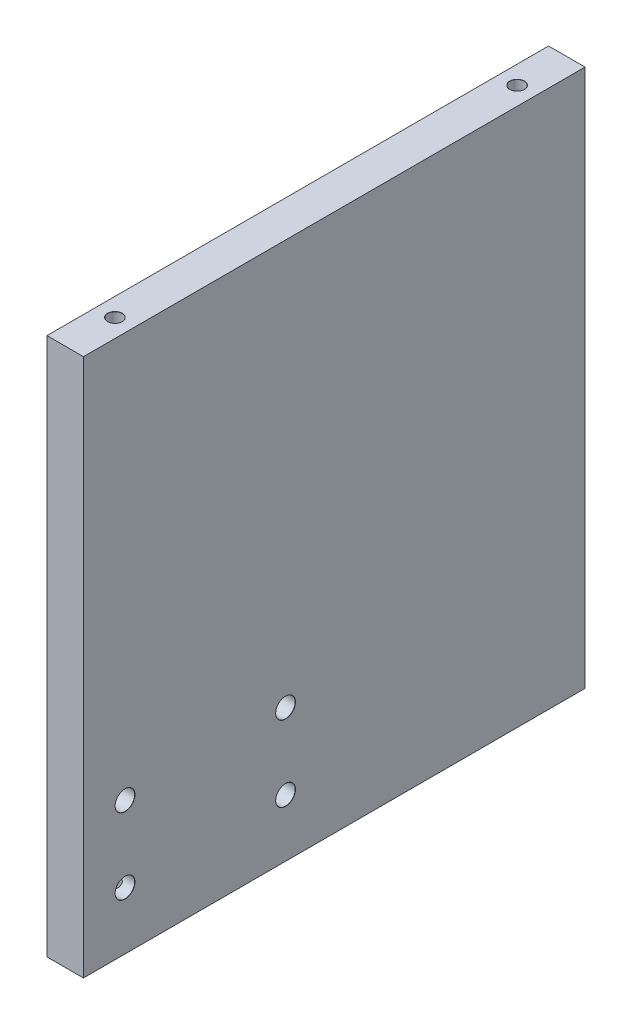
from build123d import *

# Parameters (mm, degrees)
SKETCH1_W                             = 87.3
SKETCH1_H                             = 93.65
BOSS_EXTRUDE1_DEPTH                   = 6.35
TAP_DRILL_FOR_M3X0_5_TAP1_D           = 2.5
TAP_DRILL_FOR_M3X0_5_TAP1_DEPTH       = 10
TAP_DRILL_FOR_M3X0_5_TAP1_CSINK_D     = 2.55
TAP_DRILL_FOR_M3X0_5_TAP1_CSINK_ANGLE = 90
TAP_DRILL_FOR_M3X0_5_TAP1_TIP         = 0.751075774
TAP_DRILL_FOR_M3X0_5_TAP2_D           = 2.5
TAP_DRILL_FOR_M3X0_5_TAP2_DEPTH       = 9.248924226
TAP_DRILL_FOR_M3X0_5_TAP2_CSINK_D     = 2.55
TAP_DRILL_FOR_M3X0_5_TAP2_CSINK_ANGLE = 90
TAP_DRILL_FOR_M3X0_5_TAP2_TIP         = 0.751075774
M3_CLEARANCE_HOLE1_D                  = 3.4
M3_CLEARANCE_HOLE1_CSINK_D            = 3.45
M3_CLEARANCE_HOLE1_CSINK_ANGLE        = 90


with BuildPart() as part:
    # Sketch1 → Boss-Extrude1 (new body)
    with BuildSketch(Plane(origin=(0, 0, 0), x_dir=(0, 0, -1), z_dir=(1, 0, 0))):
        Rectangle(SKETCH1_W, SKETCH1_H)
    extrude(amount=BOSS_EXTRUDE1_DEPTH)

    # Tap Drill for M3x0.5 Tap1
    with Locations(Plane(origin=(0, 46.825, 0), x_dir=(1, 0, 0), z_dir=(0, 1, 0))):
        with Locations((3.175, 35), (3.175, -35)):
            CounterSinkHole(TAP_DRILL_FOR_M3X0_5_TAP1_D / 2, TAP_DRILL_FOR_M3X0_5_TAP1_CSINK_D / 2, depth=TAP_DRILL_FOR_M3X0_5_TAP1_DEPTH, counter_sink_angle=TAP_DRILL_FOR_M3X0_5_TAP1_CSINK_ANGLE)
            with Locations((0, 0, -(TAP_DRILL_FOR_M3X0_5_TAP1_DEPTH + TAP_DRILL_FOR_M3X0_5_TAP1_TIP / 2))):  # 118° drill point
                Cone(0, TAP_DRILL_FOR_M3X0_5_TAP1_D / 2, TAP_DRILL_FOR_M3X0_5_TAP1_TIP, mode=Mode.SUBTRACT)

    # Tap Drill for M3x0.5 Tap2
    with Locations(Plane(origin=(0, -46.825, 0), x_dir=(-1, 0, 0), z_dir=(0, -1, 0))):
        with Locations((-3.175, -35), (-3.175, 35)):
            CounterSinkHole(TAP_DRILL_FOR_M3X0_5_TAP2_D / 2, TAP_DRILL_FOR_M3X0_5_TAP2_CSINK_D / 2, depth=TAP_DRILL_FOR_M3X0_5_TAP2_DEPTH, counter_sink_angle=TAP_DRILL_FOR_M3X0_5_TAP2_CSINK_ANGLE)
            with Locations((0, 0, -(TAP_DRILL_FOR_M3X0_5_TAP2_DEPTH + TAP_DRILL_FOR_M3X0_5_TAP2_TIP / 2))):  # 118° drill point
                Cone(0, TAP_DRILL_FOR_M3X0_5_TAP2_D / 2, TAP_DRILL_FOR_M3X0_5_TAP2_TIP, mode=Mode.SUBTRACT)

    # M3 Clearance Hole1 (through all)
    with Locations(Plane(origin=(6.35, 0, 0), x_dir=(0, 0, -1), z_dir=(1, 0, 0))):
        with Locations((-36.41, -23.655), (-8.47, -23.655), (-8.47, -36.825), (-36.41, -36.825)):
            CounterSinkHole(M3_CLEARANCE_HOLE1_D / 2, M3_CLEARANCE_HOLE1_CSINK_D / 2, counter_sink_angle=M3_CLEARANCE_HOLE1_CSINK_ANGLE)


solid = part.part
